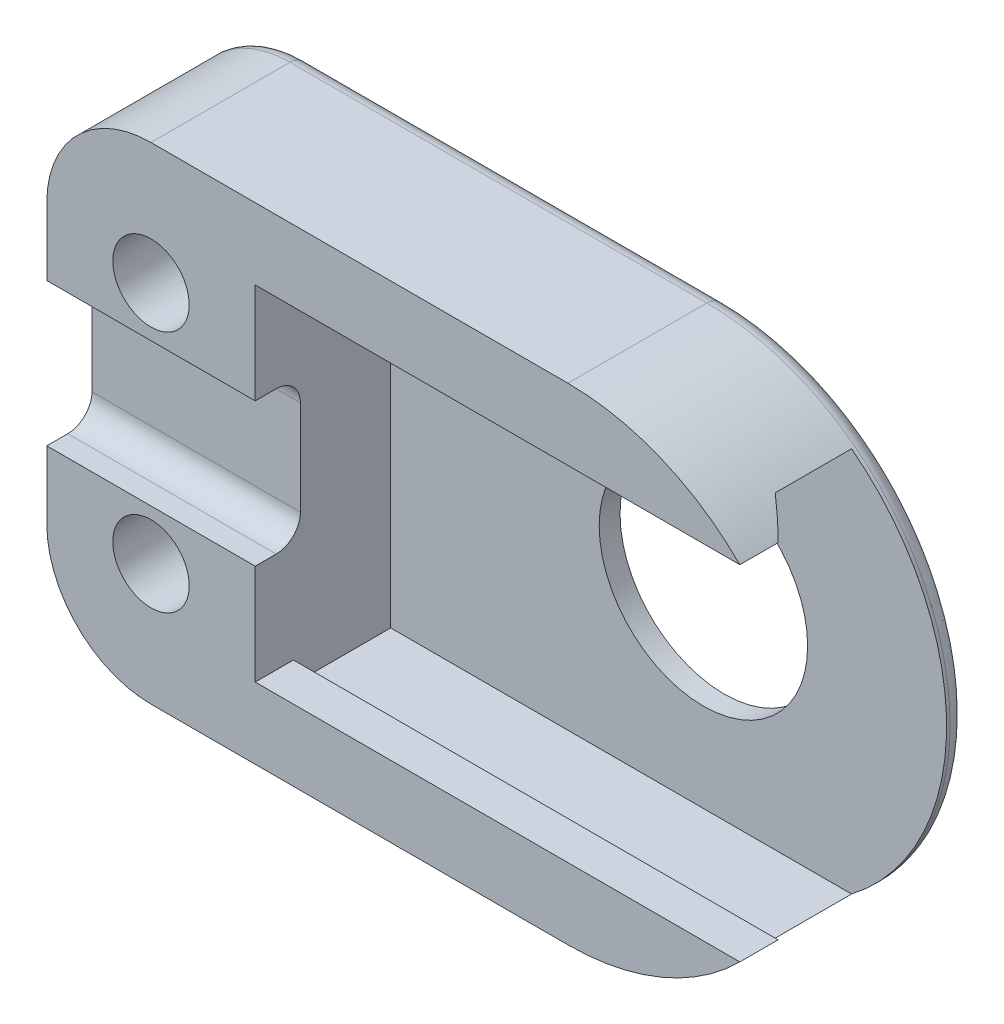
from build123d import *

# Parameters (mm, degrees)
SKETCH1_R           = 1.1
BOSS_EXTRUDE1_DEPTH = 4.5
SKETCH2_R           = 3
CUT_EXTRUDE2_DEPTH  = 10
CUT_EXTRUDE4_START  = -6
CUT_EXTRUDE4_DEPTH  = 18.521266973
CUT_EXTRUDE6_DEPTH  = 24.521266973
FILLET4_R           = 3
FILLET1_R           = 0.5
SKETCH5_R           = 1.75
CUT_EXTRUDE5_DEPTH  = 1


with BuildPart() as part:
    # Sketch1 → Boss-Extrude1 (new body)
    with BuildSketch(Plane.XY):
        with BuildLine():
            Line((-15, 7), (0, 7))
            ThreePointArc((0, 7), (7, 0), (0, -7))
            Line((0, -7), (-15, -7))
            Line((-15, -7), (-15, 7))
        make_face()
        with Locations((-12, 3.5)):
            Circle(SKETCH1_R, mode=Mode.SUBTRACT)
        with Locations(Location((-12, -3.5, 0), (0, 0, 180))):
            Circle(SKETCH1_R, mode=Mode.SUBTRACT)
    extrude(amount=BOSS_EXTRUDE1_DEPTH)

    # Sketch2 → Cut-Extrude2 (cut)
    with BuildSketch(Plane(origin=(0, 0, 0), x_dir=(-1, 0, 0), z_dir=(0, 0, -1))):
        Circle(SKETCH2_R)
    extrude(amount=-CUT_EXTRUDE2_DEPTH, mode=Mode.SUBTRACT)

    # Sketch7 → Cut-Extrude4 (cut, through all)
    with BuildSketch(Plane.ZY.offset(15).offset(CUT_EXTRUDE4_START)):
        Polygon((2.8, 5.55), (0.6, 5.55), (0.6, 0), (4.5, 0), (4.5, 4.95), (3.4, 4.95), align=None)
        Polygon((4.5, 0), (0.6, 0), (0.6, -5.55), (2.8, -5.55), (3.4, -4.95), (4.5, -4.95), align=None)
    extrude(amount=-CUT_EXTRUDE4_DEPTH, mode=Mode.SUBTRACT)

    # Sketch8 → Cut-Extrude6 (cut, through all)
    with BuildSketch(Plane.ZY.offset(15)):
        with BuildLine():
            Line((3.2, 1.363340016), (3.2, -1.363340016))
            ThreePointArc((3.2, -1.363340016), (3.404046985, -1.855953015), (3.896659984, -2.06))
            Line((3.896659984, -2.06), (4.5, -2.06))
            Line((4.5, -2.06), (4.5, 2.06))
            Line((4.5, 2.06), (3.896659984, 2.06))
            ThreePointArc((3.896659984, 2.06), (3.404046985, 1.855953015), (3.2, 1.363340016))
        make_face()
    extrude(amount=-CUT_EXTRUDE6_DEPTH, mode=Mode.SUBTRACT)

    # Fillet4
    fillet4_edges = [part.edges().sort_by_distance(p)[0] for p in [
        (-15, -7, 2.25),
        (-15, 7, 2.25),
    ]]
    fillet(fillet4_edges, radius=FILLET4_R)

    # Fillet1
    fillet1_edges = [part.edges().sort_by_distance(p)[0] for p in [
        (-6, 7, 0),
        (7, 0, 0),
        (-15, 0, 0),
        (-6, -7, 0),
        (-14.121320344, -6.121320344, 0),
        (-14.121320344, 6.121320344, 0),
    ]]
    fillet(fillet1_edges, radius=FILLET1_R)

    # Sketch5 → Cut-Extrude5 (cut)
    with BuildSketch(Plane.XY):
        with Locations(Location((-12, 3.5, 0), (0, 0, 180))):
            Circle(SKETCH5_R)
        with Locations(Location((-12, -3.5, 0), (0, 0, 180))):
            Circle(SKETCH5_R)
    extrude(amount=CUT_EXTRUDE5_DEPTH, mode=Mode.SUBTRACT)


solid = part.part
